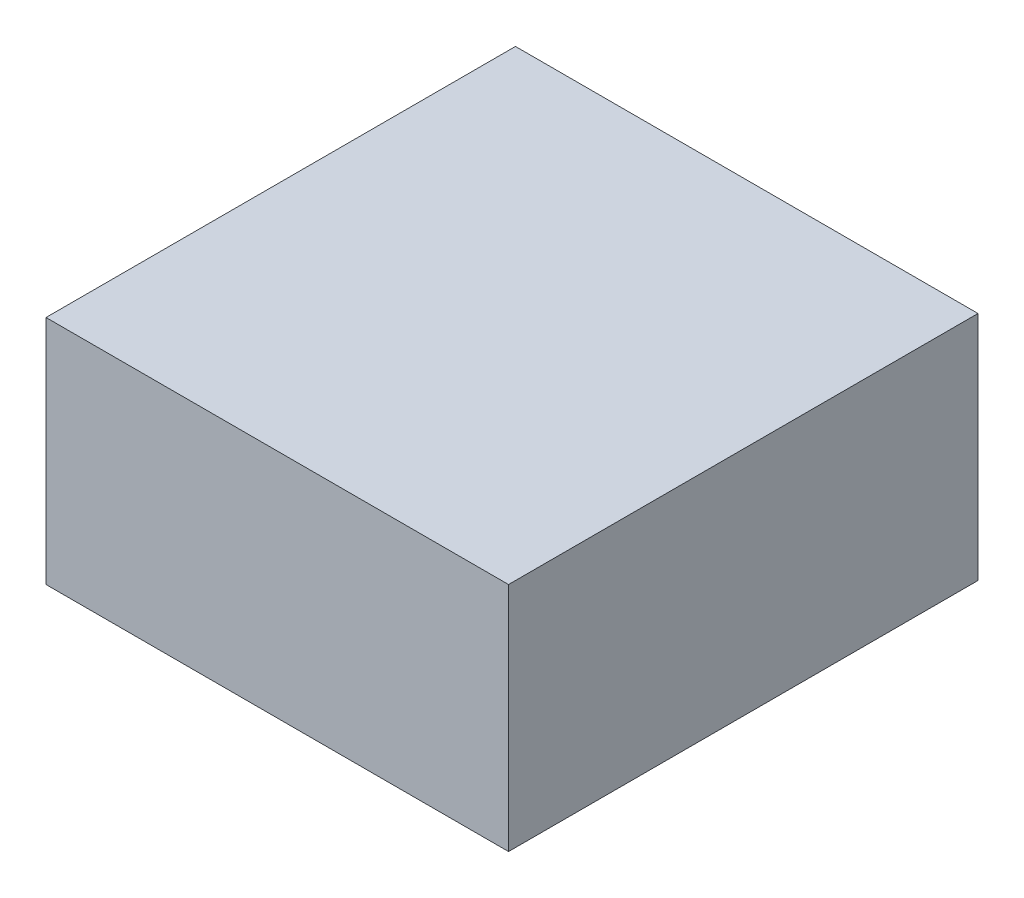
from build123d import *

# Parameters (mm, degrees)
SKETCH1_W           = 200
SKETCH1_H           = 100
BOSS_EXTRUDE1_DEPTH = 203


with BuildPart() as part:
    # Sketch1 → Boss-Extrude1 (new body)
    with BuildSketch(Plane.XY):
        Rectangle(SKETCH1_W, SKETCH1_H)
    extrude(amount=BOSS_EXTRUDE1_DEPTH)


solid = part.part
